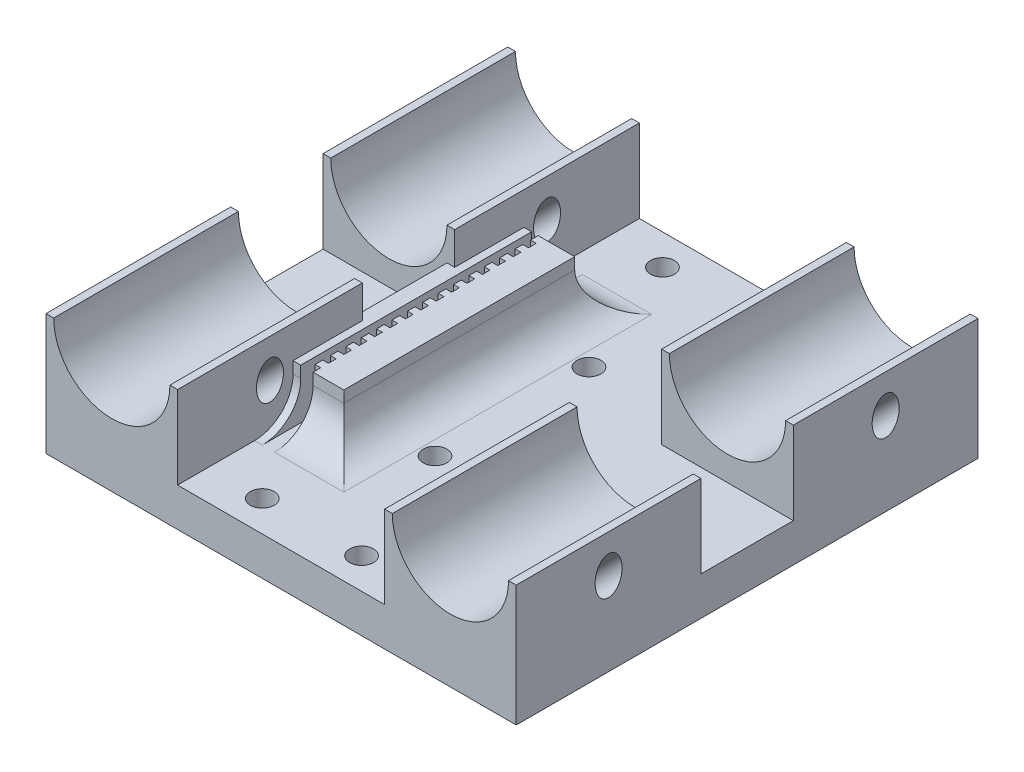
from build123d import *

# Parameters (mm, degrees)
SKETCH1_W               = 61.1
SKETCH1_H               = 60
BOSS_EXTRUDE1_DEPTH     = 5
BOSS_EXTRUDE2_DEPTH     = 24
MIRROR2_COPY_1_DEPTH    = 24
MIRROR2_COPY_2_DEPTH    = 24
SKETCH3_R               = 1.75
CUT_EXTRUDE1_DEPTH      = 60.592417722
MIRROR4_COPY_1_SKETCH_R = 1.75
MIRROR4_COPY_1_DEPTH    = 60.592417722
MIRROR5_COPY_1_SKETCH_R = 1.75
MIRROR5_COPY_1_DEPTH    = 60.592417722
MIRROR5_COPY_2_SKETCH_R = 1.75
MIRROR5_COPY_2_DEPTH    = 60.592417722
MIRROR5_COPY_3_SKETCH_R = 1.75
MIRROR5_COPY_3_DEPTH    = 60.592417722
SKETCH10_R              = 1.55
CUT_EXTRUDE7_DEPTH      = 8
SKETCH11_R              = 3
CUT_EXTRUDE8_DEPTH      = 1
SKETCH12_W              = 4
SKETCH12_H              = 30
SKETCH12_W_2            = 2
BOSS_EXTRUDE5_DEPTH     = 6.5
FILLET1_R               = 5
SKETCH12_4_W            = 0.75
SKETCH12_4_H            = 1
BOSS_EXTRUDE6_DEPTH     = 6.5
LPATTERN1_COUNT         = 15
LPATTERN1_PITCH         = 2
SKETCH13_R              = 1.55
CUT_EXTRUDE9_DEPTH      = 6.5


with BuildPart() as part:
    # Sketch1 → Boss-Extrude1 (new body)
    with BuildSketch(Plane(origin=(0, 0, 0), x_dir=(1, 0, 0), z_dir=(0, 1, 0))):
        Rectangle(SKETCH1_W, SKETCH1_H)
    extrude(amount=BOSS_EXTRUDE1_DEPTH)

    # Sketch2 → Boss-Extrude2 (add)
    with BuildSketch(Plane.XY.offset(30)):
        with BuildLine():
            Line((-30.55, 15.75), (-30.55, 5))
            Line((-30.55, 5), (-13.45, 5))
            Line((-13.45, 5), (-13.45, 15.75))
            Line((-13.45, 15.75), (-14.45, 15.75))
            ThreePointArc((-14.45, 15.75), (-22, 8.2), (-29.55, 15.75))
            Line((-29.55, 15.75), (-30.55, 15.75))
        make_face()
    boss_extrude2 = extrude(amount=-BOSS_EXTRUDE2_DEPTH)

    # Mirror1: Boss-Extrude2 across plane
    add(boss_extrude2.mirror(Plane.XY))

    # Mirror2 copy 1 sketch → Mirror2 copy 1 (add)
    with BuildSketch(Plane(origin=(0, 0, -30), x_dir=(-1, 0, 0), z_dir=(0, 0, -1))):
        with BuildLine():
            Line((-30.55, 15.75), (-30.55, 5))
            Line((-30.55, 5), (-13.45, 5))
            Line((-13.45, 5), (-13.45, 15.75))
            Line((-13.45, 15.75), (-14.45, 15.75))
            ThreePointArc((-14.45, 15.75), (-22, 8.2), (-29.55, 15.75))
            Line((-29.55, 15.75), (-30.55, 15.75))
        make_face()
    extrude(amount=-MIRROR2_COPY_1_DEPTH)

    # Mirror2 copy 2 sketch → Mirror2 copy 2 (add)
    with BuildSketch(Plane(origin=(0, 0, 30), x_dir=(-1, 0, 0), z_dir=(0, 0, 1))):
        with BuildLine():
            Line((-30.55, -15.75), (-30.55, -5))
            Line((-30.55, -5), (-13.45, -5))
            Line((-13.45, -5), (-13.45, -15.75))
            Line((-13.45, -15.75), (-14.45, -15.75))
            ThreePointArc((-14.45, -15.75), (-22, -8.2), (-29.55, -15.75))
            Line((-29.55, -15.75), (-30.55, -15.75))
        make_face()
    extrude(amount=-MIRROR2_COPY_2_DEPTH)

    # Sketch3 → Cut-Extrude1 (cut, symmetric)
    with BuildSketch(Plane(origin=(-17.775, 17.775, 0), x_dir=(0.7071067811865477, 0.7071067811865475, 0), z_dir=(-0.7071067811865475, 0.7071067811865477, 0))):
        with Locations((-13.965180362, -18)):
            Circle(SKETCH3_R)
    cut_extrude1 = extrude(amount=CUT_EXTRUDE1_DEPTH, both=True, mode=Mode.SUBTRACT)

    # Mirror3: Cut-Extrude1 across plane
    add(cut_extrude1.mirror(Plane.ZY.offset(22)), mode=Mode.SUBTRACT)

    # Mirror4: Cut-Extrude1 across plane
    add(cut_extrude1.mirror(Plane.XY), mode=Mode.SUBTRACT)

    # Mirror4 copy 1 sketch → Mirror4 copy 1 (cut, symmetric)
    with BuildSketch(Plane(origin=(-26.225, 17.775, 0), x_dir=(-0.7071067811865477, 0.7071067811865475, 0), z_dir=(0.7071067811865475, 0.7071067811865477, 0))):
        with Locations((-13.965180362, -18)):
            Circle(MIRROR4_COPY_1_SKETCH_R)
    extrude(amount=MIRROR4_COPY_1_DEPTH, both=True, mode=Mode.SUBTRACT)

    # Mirror5: Cut-Extrude1 across plane
    add(cut_extrude1.mirror(Plane(origin=(0, 0, 0), x_dir=(0, 0, 1), z_dir=(1, 0, 0))), mode=Mode.SUBTRACT)

    # Mirror5 copy 1 sketch → Mirror5 copy 1 (cut, symmetric)
    with BuildSketch(Plane(origin=(26.225, 17.775, 0), x_dir=(0.7071067811865477, 0.7071067811865475, 0), z_dir=(-0.7071067811865475, 0.7071067811865477, 0))):
        with Locations((-13.965180362, -18)):
            Circle(MIRROR5_COPY_1_SKETCH_R)
    extrude(amount=MIRROR5_COPY_1_DEPTH, both=True, mode=Mode.SUBTRACT)

    # Mirror5 copy 2 sketch → Mirror5 copy 2 (cut, symmetric)
    with BuildSketch(Plane(origin=(17.775, 17.775, 0), x_dir=(-0.7071067811865477, 0.7071067811865475, 0), z_dir=(0.7071067811865475, 0.7071067811865477, 0))):
        with Locations((-13.965180362, -18)):
            Circle(MIRROR5_COPY_2_SKETCH_R)
    extrude(amount=MIRROR5_COPY_2_DEPTH, both=True, mode=Mode.SUBTRACT)

    # Mirror5 copy 3 sketch → Mirror5 copy 3 (cut, symmetric)
    with BuildSketch(Plane(origin=(26.225, 17.775, 0), x_dir=(0.7071067811865477, 0.7071067811865475, 0), z_dir=(-0.7071067811865475, 0.7071067811865477, 0))):
        with Locations((-13.965180362, 18)):
            Circle(MIRROR5_COPY_3_SKETCH_R)
    extrude(amount=MIRROR5_COPY_3_DEPTH, both=True, mode=Mode.SUBTRACT)

    # Sketch10 → Cut-Extrude7 (cut)
    with BuildSketch(Plane(origin=(0, 5, 0), x_dir=(1, 0, 0), z_dir=(0, 1, 0))):
        with Locations((-6.45, -26)):
            Circle(SKETCH10_R)
        with Locations((-6.45, 26)):
            Circle(SKETCH10_R)
        with Locations((6.45, 26)):
            Circle(SKETCH10_R)
        with Locations((6.45, -26)):
            Circle(SKETCH10_R)
    extrude(amount=-CUT_EXTRUDE7_DEPTH, mode=Mode.SUBTRACT)

    # Sketch11 → Cut-Extrude8 (cut)
    with BuildSketch(Plane.XZ):
        with Locations((-6.45, 26)):
            Circle(SKETCH11_R)
        with Locations((6.45, 26)):
            Circle(SKETCH11_R)
        with Locations((6.45, -26)):
            Circle(SKETCH11_R)
        with Locations((-6.45, -26)):
            Circle(SKETCH11_R)
    extrude(amount=-CUT_EXTRUDE8_DEPTH, mode=Mode.SUBTRACT)

    # Sketch12 → Boss-Extrude5 (add)
    with BuildSketch(Plane(origin=(0, 5, 0), x_dir=(1, 0, 0), z_dir=(0, 1, 0))):
        with Locations((-8.85, 0)):
            Rectangle(SKETCH12_W, SKETCH12_H)
        with Locations((-13.45, 0)):
            Rectangle(SKETCH12_W_2, SKETCH12_H)
    extrude(amount=BOSS_EXTRUDE5_DEPTH)

    # Fillet1
    fillet1_edges = [part.edges().sort_by_distance(p)[0] for p in [
        (-8.85, 5, 15),
        (-6.85, 5, 0),
        (-8.85, 5, -15),
        (-12.95, 5, -15),
        (-14.45, 5, 0),
        (-12.95, 5, 15),
    ]]
    fillet(fillet1_edges, radius=FILLET1_R)

    # Sketch12<4> → Boss-Extrude6 (add)
    with BuildSketch(Plane(origin=(0, 5, 0), x_dir=(1, 0, 0), z_dir=(0, 1, 0))):
        with Locations((-11.225, 14.5)):
            Rectangle(SKETCH12_4_W, SKETCH12_4_H)
    boss_extrude6 = extrude(amount=BOSS_EXTRUDE6_DEPTH)

    # LPattern1: Boss-Extrude6 ×15
    with Locations(*[(0, 0, i * LPATTERN1_PITCH) for i in range(1, LPATTERN1_COUNT)]):
        add(boss_extrude6)

    # Sketch13 → Cut-Extrude9 (cut)
    with BuildSketch(Plane.XZ):
        with Locations((0, 10)):
            Circle(SKETCH13_R)
        with Locations((0, -10)):
            Circle(SKETCH13_R)
    extrude(amount=-CUT_EXTRUDE9_DEPTH, mode=Mode.SUBTRACT)


solid = part.part
